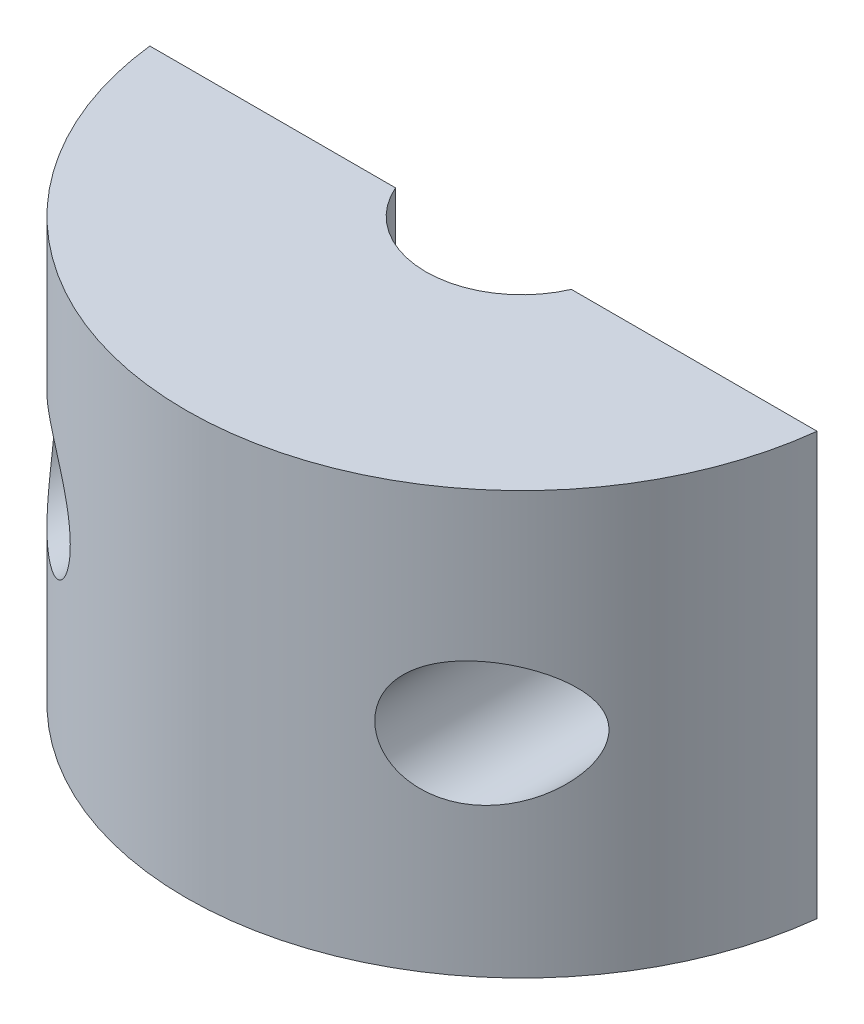
from build123d import *

# Parameters (mm, degrees)
BOSS_EXTRUDE1_DEPTH = 22
SKETCH3_R           = 1.75
CUT_EXTRUDE1_DEPTH  = 22
SKETCH4_R           = 3.25
CUT_EXTRUDE2_DEPTH  = 22
SKETCH5_W           = 35.231138993
SKETCH5_H           = 1
CUT_EXTRUDE3_DEPTH  = 22


with BuildPart() as part:
    # Sketch2 → Boss-Extrude1 (new body)
    with BuildSketch(Plane(origin=(0, 0, 0), x_dir=(1, 0, 0), z_dir=(0, 1, 0))):
        with BuildLine():
            Line((4.898979486, -1), (17.47140521, -1))
            ThreePointArc((17.47140521, -1), (0, -17.5), (-17.47140521, -1))
            Line((-17.47140521, -1), (-4.898979486, -1))
            ThreePointArc((-4.898979486, -1), (0, -5), (4.898979486, -1))
        make_face()
    extrude(amount=BOSS_EXTRUDE1_DEPTH)

    # Sketch3 → Cut-Extrude1 (cut)
    with BuildSketch(Plane(origin=(0, 0, 1), x_dir=(-1, 0, 0), z_dir=(0, 0, -1))):
        with Locations((11.185192348, 11)):
            Circle(SKETCH3_R)
        with Locations((-11.185192348, 11)):
            Circle(SKETCH3_R)
    extrude(amount=-CUT_EXTRUDE1_DEPTH, mode=Mode.SUBTRACT)

    # Sketch4 → Cut-Extrude2 (cut)
    with BuildSketch(Plane(origin=(0, 0, 5), x_dir=(-1, 0, 0), z_dir=(0, 0, -1))):
        with Locations((-11.185192348, 11)):
            Circle(SKETCH4_R)
        with Locations((11.185192348, 11)):
            Circle(SKETCH4_R)
    extrude(amount=-CUT_EXTRUDE2_DEPTH, mode=Mode.SUBTRACT)

    # Sketch5 → Cut-Extrude3 (cut)
    with BuildSketch(Plane(origin=(0, 22, 0), x_dir=(1, 0, 0), z_dir=(0, 1, 0))):
        with Locations((0.144164287, -1.5)):
            Rectangle(SKETCH5_W, SKETCH5_H)
    extrude(amount=-CUT_EXTRUDE3_DEPTH, mode=Mode.SUBTRACT)


solid = part.part
